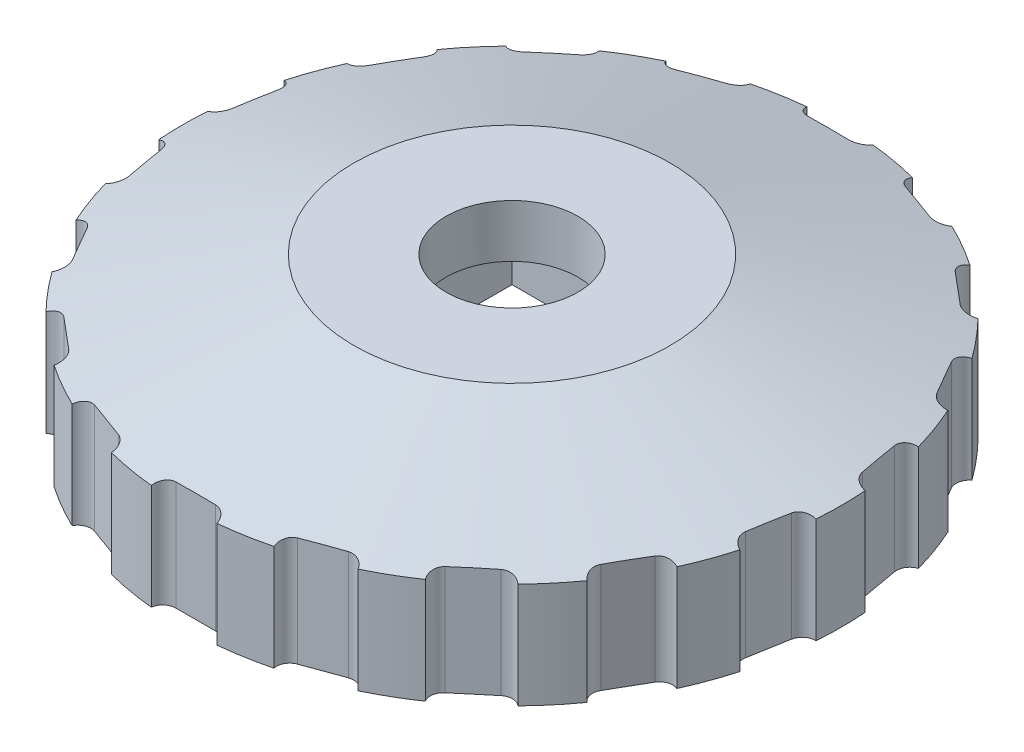
from build123d import *

# Parameters (mm, degrees)
CUT_EXTRUDE1_DEPTH = 10
SKETCH4_W          = 10
SKETCH4_H          = 10
CUT_EXTRUDE2_DEPTH = 4


with BuildPart() as part:
    # Sketch1 → Revolve1 (revolve)
    with BuildSketch(Plane.XY, mode=Mode.PRIVATE) as revolve1_sk:
        Polygon((2.5, 0), (12.5, 0), (12.5, 4), (6, 6), (2.5, 6), align=None)
    revolve(revolve1_sk.sketch.rotate(Axis((0, 6, 0), (0, -1, 0)), 180), axis=Axis((0, 6, 0), (0, -1, 0)))

    # Sketch2 → Cut-Extrude1 (cut)
    with BuildSketch(Plane.XZ):
        with BuildLine():
            Line((-0.75, 13), (0.75, 13))
            ThreePointArc((0.75, 13), (1.25, 12.5), (0.75, 12))
            Line((0.75, 12), (-0.75, 12))
            ThreePointArc((-0.75, 12), (-1.25, 12.5), (-0.75, 13))
        make_face()
        with BuildLine():
            Line((3.741492398, 12.472519178), (5.151031329, 11.959488963))
            ThreePointArc((5.151031329, 11.959488963), (5.449867568, 11.318632581), (4.809011185, 11.019796342))
            Line((4.809011185, 11.019796342), (3.399472254, 11.532826557))
            ThreePointArc((3.399472254, 11.532826557), (3.100636016, 12.173682939), (3.741492398, 12.472519178))
        make_face()
        with BuildLine():
            Line((7.781705594, 10.440668468), (8.930772258, 9.476487053))
            ThreePointArc((8.930772258, 9.476487053), (8.992400675, 8.772071027), (8.287984649, 8.71044261))
            Line((8.287984649, 8.71044261), (7.138917984, 9.674624025))
            ThreePointArc((7.138917984, 9.674624025), (7.077289567, 10.379040051), (7.781705594, 10.440668468))
        make_face()
        with BuildLine():
            Line((10.883330249, 7.149519053), (11.633330249, 5.850480947))
            ThreePointArc((11.633330249, 5.850480947), (11.450317547, 5.167468245), (10.767304845, 5.350480947))
            Line((10.767304845, 5.350480947), (10.017304845, 6.649519053))
            ThreePointArc((10.017304845, 6.649519053), (10.200317547, 7.332531755), (10.883330249, 7.149519053))
        make_face()
        with BuildLine():
            Line((12.672264656, 2.996032124), (12.932736922, 1.518820495))
            ThreePointArc((12.932736922, 1.518820495), (12.527157135, 0.93959253), (11.947929169, 1.345172317))
            Line((11.947929169, 1.345172317), (11.687456903, 2.822383947))
            ThreePointArc((11.687456903, 2.822383947), (12.093036691, 3.401611912), (12.672264656, 2.996032124))
        make_face()
        with BuildLine():
            Line((12.932736922, -1.518820495), (12.672264656, -2.996032124))
            ThreePointArc((12.672264656, -2.996032124), (12.093036691, -3.401611912), (11.687456903, -2.822383947))
            Line((11.687456903, -2.822383947), (11.947929169, -1.345172317))
            ThreePointArc((11.947929169, -1.345172317), (12.527157135, -0.93959253), (12.932736922, -1.518820495))
        make_face()
        with BuildLine():
            Line((11.633330249, -5.850480947), (10.883330249, -7.149519053))
            ThreePointArc((10.883330249, -7.149519053), (10.200317547, -7.332531755), (10.017304845, -6.649519053))
            Line((10.017304845, -6.649519053), (10.767304845, -5.350480947))
            ThreePointArc((10.767304845, -5.350480947), (11.450317547, -5.167468245), (11.633330249, -5.850480947))
        make_face()
        with BuildLine():
            Line((8.930772258, -9.476487053), (7.781705594, -10.440668468))
            ThreePointArc((7.781705594, -10.440668468), (7.077289567, -10.379040051), (7.138917984, -9.674624025))
            Line((7.138917984, -9.674624025), (8.287984649, -8.71044261))
            ThreePointArc((8.287984649, -8.71044261), (8.992400675, -8.772071027), (8.930772258, -9.476487053))
        make_face()
        with BuildLine():
            Line((5.151031329, -11.959488963), (3.741492398, -12.472519178))
            ThreePointArc((3.741492398, -12.472519178), (3.100636016, -12.173682939), (3.399472254, -11.532826557))
            Line((3.399472254, -11.532826557), (4.809011185, -11.019796342))
            ThreePointArc((4.809011185, -11.019796342), (5.449867568, -11.318632581), (5.151031329, -11.959488963))
        make_face()
        with BuildLine():
            Line((0.75, -13), (-0.75, -13))
            ThreePointArc((-0.75, -13), (-1.25, -12.5), (-0.75, -12))
            Line((-0.75, -12), (0.75, -12))
            ThreePointArc((0.75, -12), (1.25, -12.5), (0.75, -13))
        make_face()
        with BuildLine():
            Line((-3.741492398, -12.472519178), (-5.151031329, -11.959488963))
            ThreePointArc((-5.151031329, -11.959488963), (-5.449867568, -11.318632581), (-4.809011185, -11.019796342))
            Line((-4.809011185, -11.019796342), (-3.399472254, -11.532826557))
            ThreePointArc((-3.399472254, -11.532826557), (-3.100636016, -12.173682939), (-3.741492398, -12.472519178))
        make_face()
        with BuildLine():
            Line((-7.781705594, -10.440668468), (-8.930772258, -9.476487053))
            ThreePointArc((-8.930772258, -9.476487053), (-8.992400675, -8.772071027), (-8.287984649, -8.71044261))
            Line((-8.287984649, -8.71044261), (-7.138917984, -9.674624025))
            ThreePointArc((-7.138917984, -9.674624025), (-7.077289567, -10.379040051), (-7.781705594, -10.440668468))
        make_face()
        with BuildLine():
            Line((-10.883330249, -7.149519053), (-11.633330249, -5.850480947))
            ThreePointArc((-11.633330249, -5.850480947), (-11.450317547, -5.167468245), (-10.767304845, -5.350480947))
            Line((-10.767304845, -5.350480947), (-10.017304845, -6.649519053))
            ThreePointArc((-10.017304845, -6.649519053), (-10.200317547, -7.332531755), (-10.883330249, -7.149519053))
        make_face()
        with BuildLine():
            Line((-12.672264656, -2.996032124), (-12.932736922, -1.518820495))
            ThreePointArc((-12.932736922, -1.518820495), (-12.527157135, -0.93959253), (-11.947929169, -1.345172317))
            Line((-11.947929169, -1.345172317), (-11.687456903, -2.822383947))
            ThreePointArc((-11.687456903, -2.822383947), (-12.093036691, -3.401611912), (-12.672264656, -2.996032124))
        make_face()
        with BuildLine():
            Line((-12.932736922, 1.518820495), (-12.672264656, 2.996032124))
            ThreePointArc((-12.672264656, 2.996032124), (-12.093036691, 3.401611912), (-11.687456903, 2.822383947))
            Line((-11.687456903, 2.822383947), (-11.947929169, 1.345172317))
            ThreePointArc((-11.947929169, 1.345172317), (-12.527157135, 0.93959253), (-12.932736922, 1.518820495))
        make_face()
        with BuildLine():
            Line((-11.633330249, 5.850480947), (-10.883330249, 7.149519053))
            ThreePointArc((-10.883330249, 7.149519053), (-10.200317547, 7.332531755), (-10.017304845, 6.649519053))
            Line((-10.017304845, 6.649519053), (-10.767304845, 5.350480947))
            ThreePointArc((-10.767304845, 5.350480947), (-11.450317547, 5.167468245), (-11.633330249, 5.850480947))
        make_face()
        with BuildLine():
            Line((-8.930772258, 9.476487053), (-7.781705594, 10.440668468))
            ThreePointArc((-7.781705594, 10.440668468), (-7.077289567, 10.379040051), (-7.138917984, 9.674624025))
            Line((-7.138917984, 9.674624025), (-8.287984649, 8.71044261))
            ThreePointArc((-8.287984649, 8.71044261), (-8.992400675, 8.772071027), (-8.930772258, 9.476487053))
        make_face()
        with BuildLine():
            Line((-5.151031329, 11.959488963), (-3.741492398, 12.472519178))
            ThreePointArc((-3.741492398, 12.472519178), (-3.100636016, 12.173682939), (-3.399472254, 11.532826557))
            Line((-3.399472254, 11.532826557), (-4.809011185, 11.019796342))
            ThreePointArc((-4.809011185, 11.019796342), (-5.449867568, 11.318632581), (-5.151031329, 11.959488963))
        make_face()
    extrude(amount=-CUT_EXTRUDE1_DEPTH, mode=Mode.SUBTRACT)

    # Sketch4 → Cut-Extrude2 (cut)
    with BuildSketch(Plane(origin=(0, 0, 0), x_dir=(1, 0, 0), z_dir=(0, 1, 0))):
        Rectangle(SKETCH4_W, SKETCH4_H)
    extrude(amount=CUT_EXTRUDE2_DEPTH, mode=Mode.SUBTRACT)


solid = part.part
